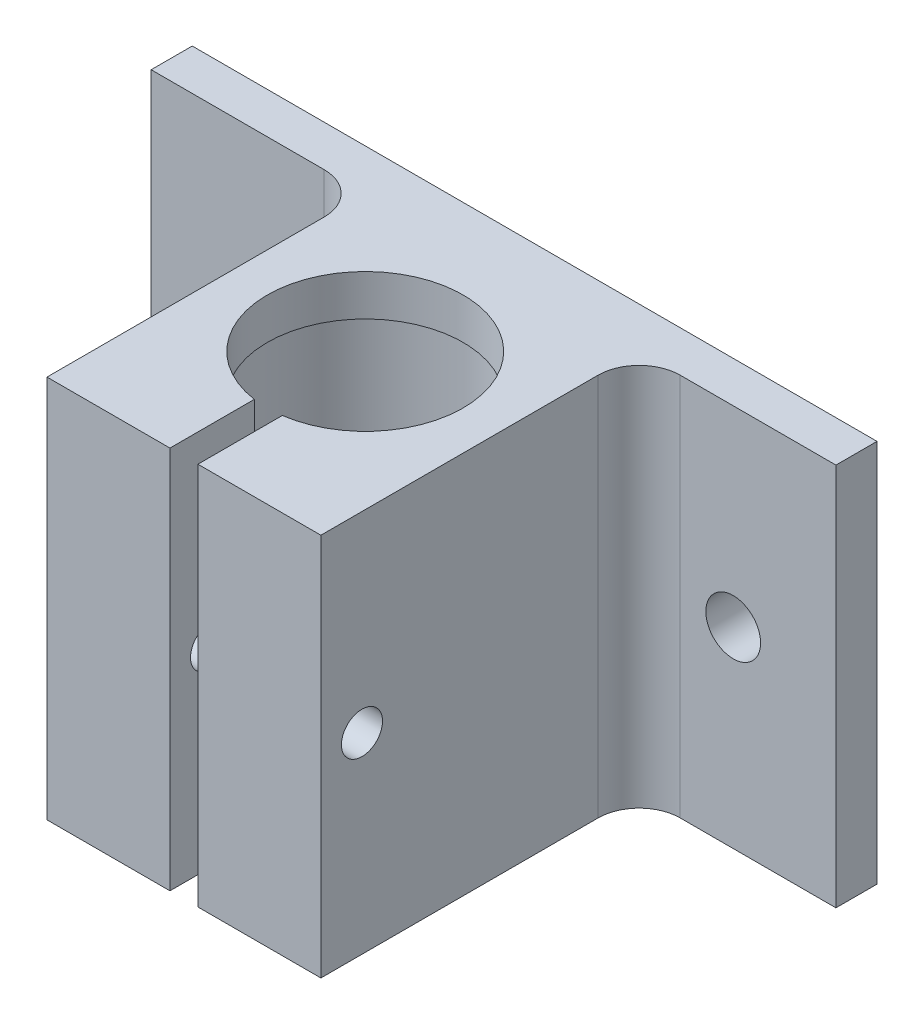
from build123d import *

# Parameters (mm, degrees)
BOSS_EXTRUDE1_DEPTH = 28
SKETCH2_R           = 1.5
CUT_EXTRUDE1_DEPTH  = 20
CUT_EXTRUDE2_DEPTH  = 2
SKETCH4_R           = 2
CUT_EXTRUDE3_DEPTH  = 3
FILLET1_R           = 3
FILLET2_R           = 3
SKETCH5_R           = 7.75
CUT_EXTRUDE4_DEPTH  = 25


with BuildPart() as part:
    # Sketch1 → Boss-Extrude1 (new body)
    with BuildSketch(Plane(origin=(0, 0, 0), x_dir=(1, 0, 0), z_dir=(0, 1, 0))):
        with BuildLine():
            Line((-25.631117397, 10), (-10, 10))
            Line((-10, 10), (-10, -13.238049007))
            Line((-10, -13.238049007), (-1.021428571, -13.238049007))
            Line((-1.021428571, -13.238049007), (-1.021428571, -7.076664728))
            ThreePointArc((-1.021428571, -7.076664728), (0, 7.15), (1.021428571, -7.076664728))
            Line((1.021428571, -7.076664728), (1.021428571, -13.238049007))
            Line((1.021428571, -13.238049007), (10, -13.238049007))
            Line((10, -13.238049007), (10, 10))
            Line((10, 10), (24.368882603, 10))
            Line((24.368882603, 10), (24.368882603, 13))
            Line((24.368882603, 13), (-25.631117397, 13))
            Line((-25.631117397, 13), (-25.631117397, 10))
        make_face()
    extrude(amount=BOSS_EXTRUDE1_DEPTH)

    # Sketch2 → Cut-Extrude1 (cut)
    with BuildSketch(Plane.ZY.offset(10)):
        with Locations((10.238049007, 14)):
            Circle(SKETCH2_R)
    extrude(amount=-CUT_EXTRUDE1_DEPTH, mode=Mode.SUBTRACT)

    # Sketch3 → Cut-Extrude2 (cut)
    with BuildSketch(Plane.ZY.offset(10)):
        Polygon((10.238049007, 17.175426481), (7.488049007, 15.58771324), (7.488049007, 12.41228676), (10.238049007, 10.824573519), (12.988049007, 12.41228676), (12.988049007, 15.58771324), align=None)
    extrude(amount=-CUT_EXTRUDE2_DEPTH, mode=Mode.SUBTRACT)

    # Sketch4 → Cut-Extrude3 (cut)
    with BuildSketch(Plane(origin=(0, 0, -13), x_dir=(-1, 0, 0), z_dir=(0, 0, -1))):
        with Locations((-16.868882603, 14)):
            Circle(SKETCH4_R)
        with Locations(Location((16.868882603, 14, 0), (0, 0, 180))):
            Circle(SKETCH4_R)
    extrude(amount=-CUT_EXTRUDE3_DEPTH, mode=Mode.SUBTRACT)

    # Fillet1
    fillet1_edges = [part.edges().sort_by_distance(p)[0] for p in [
        (10, 14, -10),
    ]]
    fillet(fillet1_edges, radius=FILLET1_R)

    # Fillet2
    fillet2_edges = [part.edges().sort_by_distance(p)[0] for p in [
        (-10, 14, -10),
    ]]
    fillet(fillet2_edges, radius=FILLET2_R)

    # Sketch5 → Cut-Extrude4 (cut)
    with BuildSketch(Plane.XZ):
        Circle(SKETCH5_R)
    extrude(amount=-CUT_EXTRUDE4_DEPTH, mode=Mode.SUBTRACT)


solid = part.part
